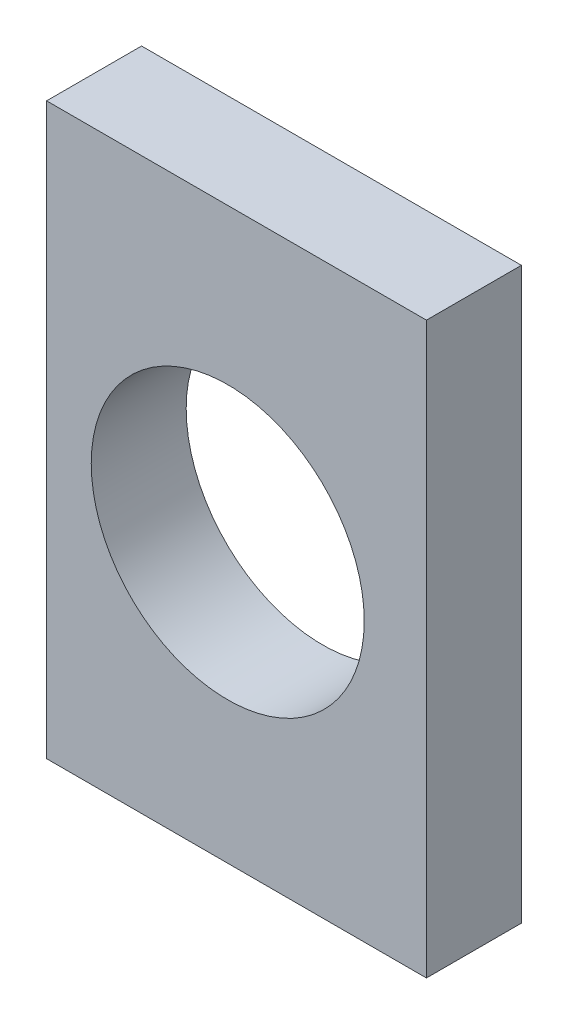
from build123d import *

# Parameters (mm, degrees)
SKETCH1_W           = 16
SKETCH1_H           = 24
SKETCH1_R           = 5.75
BOSS_EXTRUDE1_DEPTH = 4


with BuildPart() as part:
    # Sketch1 → Boss-Extrude1 (new body)
    with BuildSketch(Plane.XY):
        with Locations((6.25, 5.5)):
            Rectangle(SKETCH1_W, SKETCH1_H)
        with Locations((5.879737544, 5.212858194)):
            Circle(SKETCH1_R, mode=Mode.SUBTRACT)
    extrude(amount=BOSS_EXTRUDE1_DEPTH)


solid = part.part
